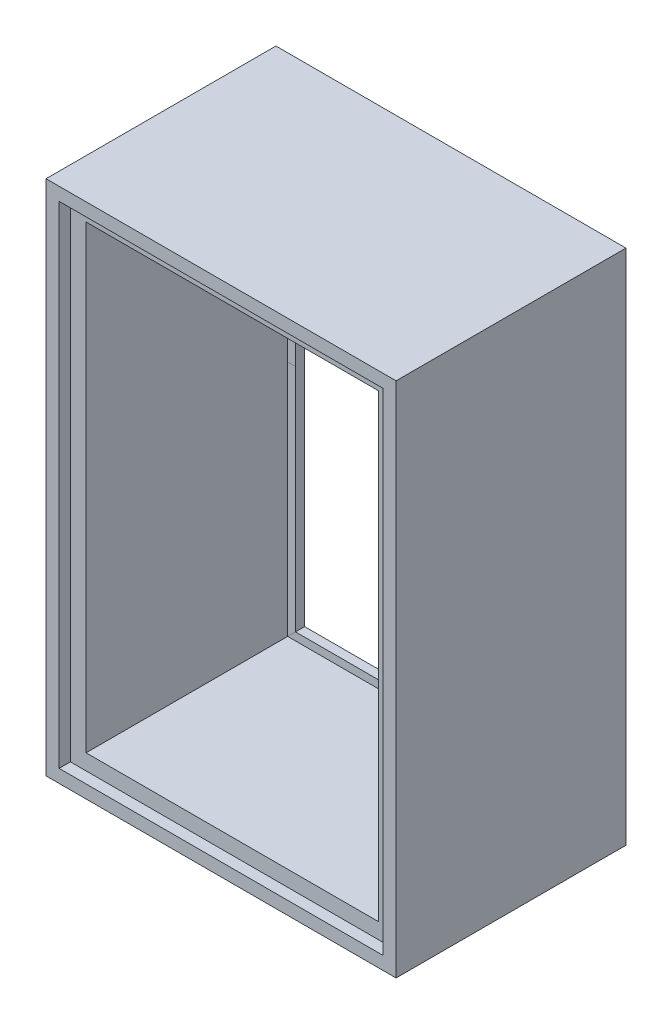
from build123d import *

# Parameters (mm, degrees)
SKETCH1_W           = 212.725
SKETCH1_H           = 314.325
SKETCH1_W_2         = 177.8
SKETCH1_H_2         = 279.4
BOSS_EXTRUDE1_DEPTH = 139.7
SKETCH4_W           = 9.525
SKETCH4_H           = 4.7625
SKETCH6_W           = 196.85
SKETCH6_H           = 298.45
SKETCH6_W_2         = 177.8
SKETCH6_H_2         = 279.4
CUT_EXTRUDE3_DEPTH  = 6.858


with BuildPart() as part:
    # Sketch1 → Boss-Extrude1 (new body)
    with BuildSketch(Plane.XY):
        Rectangle(SKETCH1_W, SKETCH1_H)
        Rectangle(SKETCH1_W_2, SKETCH1_H_2, mode=Mode.SUBTRACT)
    extrude(amount=-BOSS_EXTRUDE1_DEPTH)

    # Cut-Sweep2: sweep along a path in Sketch5
    with BuildLine(Plane(origin=(0, 0, -139.7), x_dir=(-1, 0, 0), z_dir=(0, 0, -1))) as cut_sweep2_path:
        Line((-88.9, -139.7), (-88.9, 139.7))
        Line((-88.9, 139.7), (88.9, 139.7))
        Line((88.9, 139.7), (88.9, -139.7))
        Line((88.9, -139.7), (-88.9, -139.7))
    # Sketch4 → Cut-Sweep2 (sweep, cut)
    with BuildSketch(Plane(origin=(0, 0, 0), x_dir=(1, 0, 0), z_dir=(0, 1, 0))):
        with Locations((-93.6625, 131.7625)):
            Rectangle(SKETCH4_W, SKETCH4_H)
    sweep(path=cut_sweep2_path.line, transition=Transition.RIGHT, mode=Mode.SUBTRACT)

    # Sketch6 → Cut-Extrude3 (cut)
    with BuildSketch(Plane.XY):
        Rectangle(SKETCH6_W, SKETCH6_H)
        Rectangle(SKETCH6_W_2, SKETCH6_H_2, mode=Mode.SUBTRACT)
    extrude(amount=-CUT_EXTRUDE3_DEPTH, mode=Mode.SUBTRACT)


solid = part.part
